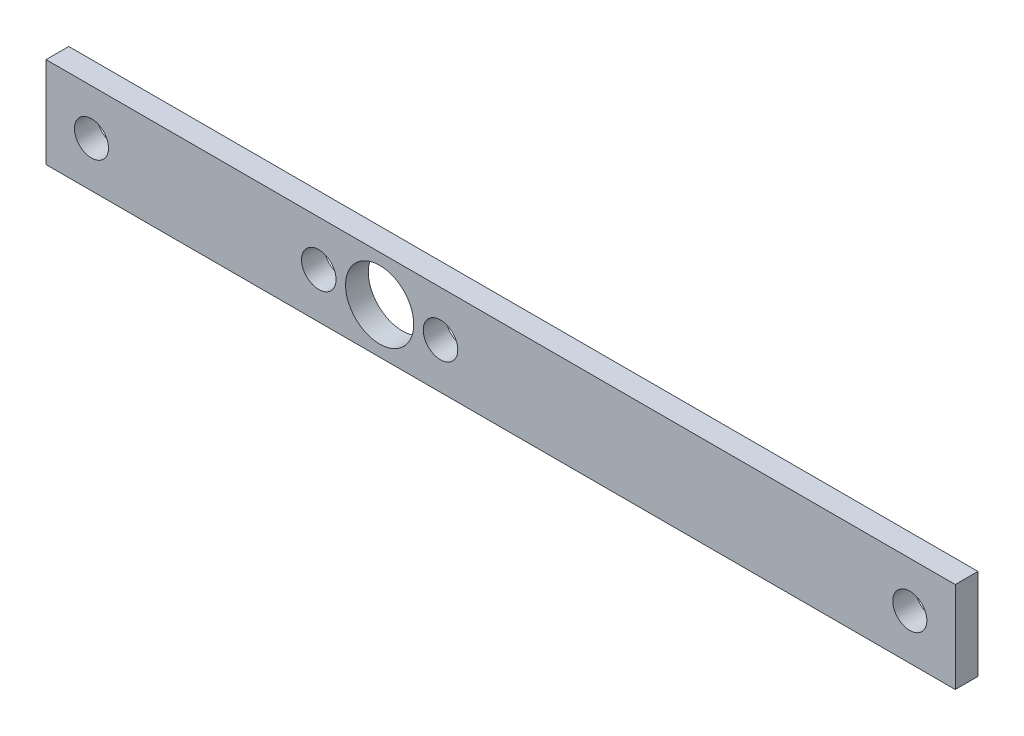
from build123d import *

# Parameters (mm, degrees)
SKETCH1_W           = 127
SKETCH1_H           = 12.7
SKETCH1_R           = 2.413
SKETCH1_R_2         = 2.38125
SKETCH1_R_3         = 4.7625
BOSS_EXTRUDE1_DEPTH = 3.175


with BuildPart() as part:
    # Sketch1 → Boss-Extrude1 (new body)
    with BuildSketch(Plane.XY):
        with Locations((63.5, 6.35)):
            Rectangle(SKETCH1_W, SKETCH1_H)
        with Locations((38.1, 6.35)):
            Circle(SKETCH1_R, mode=Mode.SUBTRACT)
        with Locations((55.1000168, 6.35)):
            Circle(SKETCH1_R, mode=Mode.SUBTRACT)
        with Locations((6.35, 6.35)):
            Circle(SKETCH1_R_2, mode=Mode.SUBTRACT)
        with Locations((120.65, 6.35)):
            Circle(SKETCH1_R_2, mode=Mode.SUBTRACT)
        with Locations((46.6000084, 6.35)):
            Circle(SKETCH1_R_3, mode=Mode.SUBTRACT)
    extrude(amount=BOSS_EXTRUDE1_DEPTH)


solid = part.part
